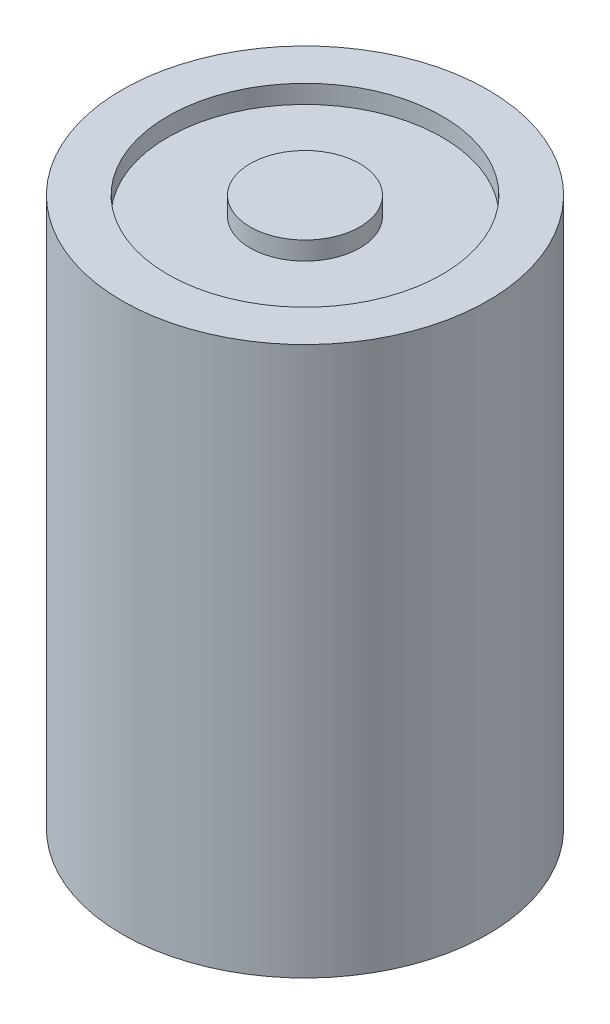
from build123d import *

# Parameters (mm, degrees)
SKETCH1_R           = 10
BOSS_EXTRUDE1_DEPTH = 30
SKETCH2_R           = 7.5
SKETCH2_R_2         = 3
CUT_EXTRUDE1_DEPTH  = 1


with BuildPart() as part:
    # Sketch1 → Boss-Extrude1 (new body)
    with BuildSketch(Plane(origin=(0, 0, 0), x_dir=(1, 0, 0), z_dir=(0, 1, 0))):
        with Locations(Location((0, 0, 0), (0, 0, 270))):
            Circle(SKETCH1_R)
    extrude(amount=BOSS_EXTRUDE1_DEPTH)

    # Sketch2 → Cut-Extrude1 (cut)
    with BuildSketch(Plane(origin=(0, 30, 0), x_dir=(1, 0, 0), z_dir=(0, 1, 0))):
        with Locations(Location((0, 0, 0), (0, 0, 270))):
            Circle(SKETCH2_R)
        with Locations(Location((0, 0, 0), (0, 0, 270))):
            Circle(SKETCH2_R_2, mode=Mode.SUBTRACT)
    extrude(amount=-CUT_EXTRUDE1_DEPTH, mode=Mode.SUBTRACT)


solid = part.part
